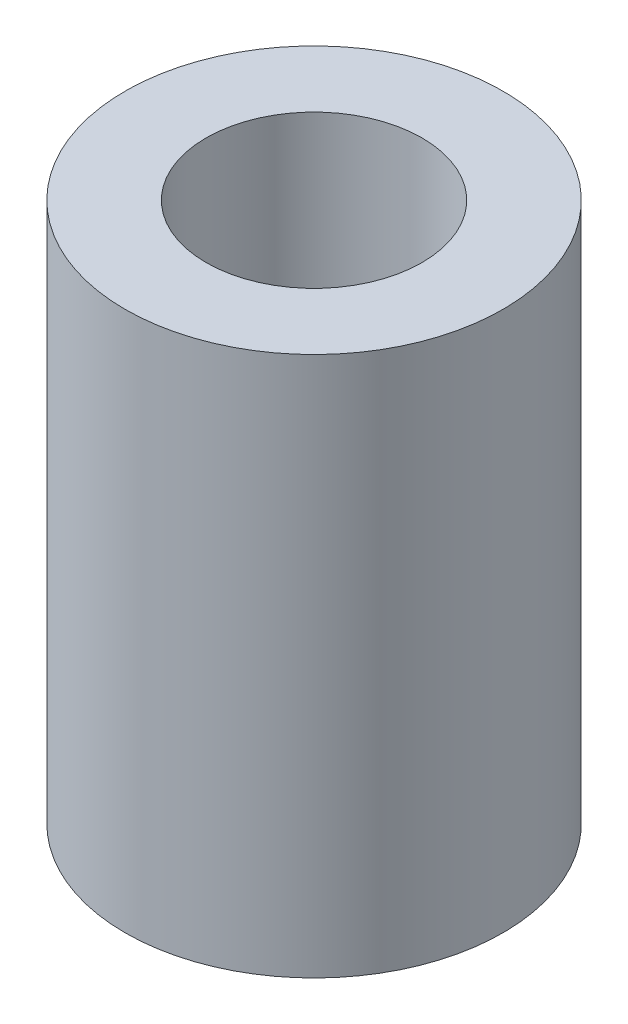
from build123d import *

# Parameters (mm, degrees)
SKETCH1_R           = 11.1125
SKETCH1_R_2         = 6.35
BOSS_EXTRUDE1_DEPTH = 31.75


with BuildPart() as part:
    # Sketch1 → Boss-Extrude1 (new body)
    with BuildSketch(Plane(origin=(0, 0, 0), x_dir=(1, 0, 0), z_dir=(0, 1, 0))):
        with Locations(Location((0, 0, 0), (0, 0, 270))):
            Circle(SKETCH1_R)
        with Locations(Location((0, 0, 0), (0, 0, 270))):
            Circle(SKETCH1_R_2, mode=Mode.SUBTRACT)
    extrude(amount=BOSS_EXTRUDE1_DEPTH)


solid = part.part
